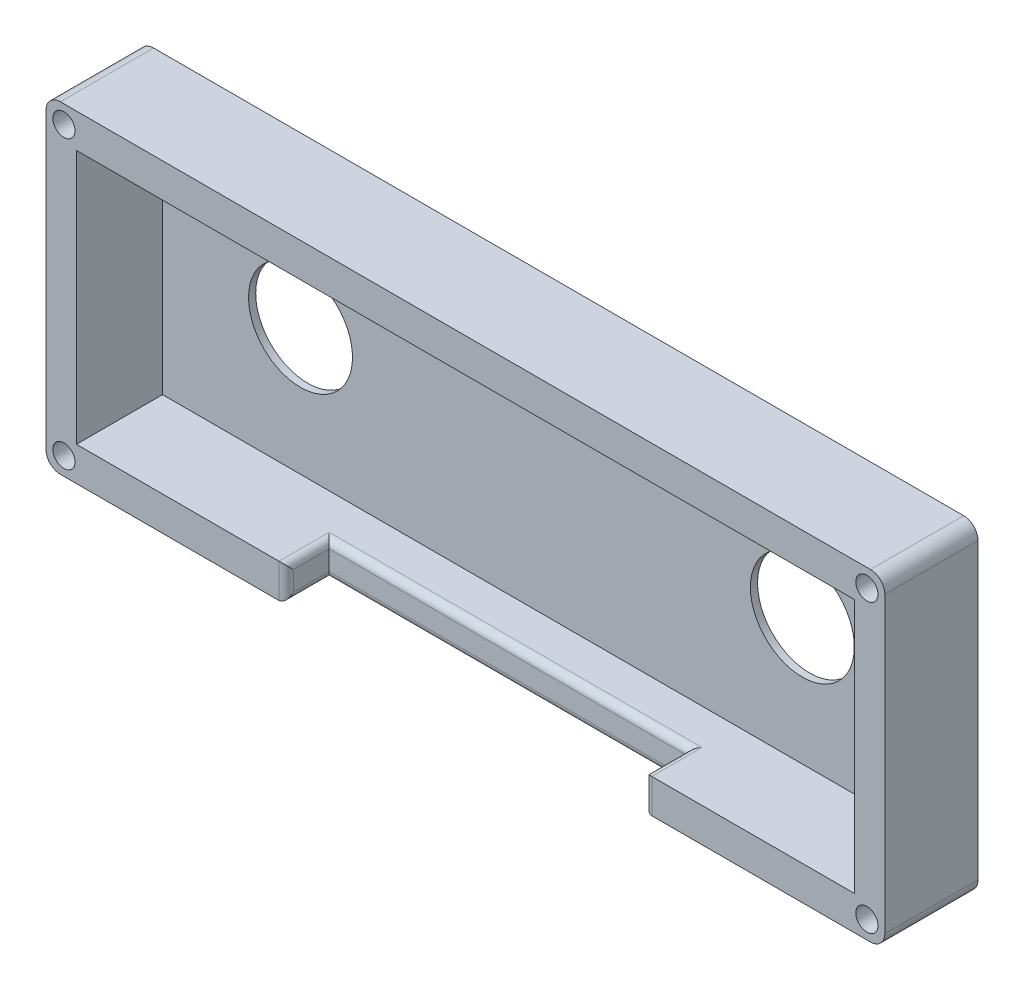
from build123d import *

# Parameters (mm, degrees)
SKETCH_1_W          = 117
SKETCH_1_H          = 45
SKETCH_1_R          = 7.25
EXTRUDE_1_DEPTH     = 13
SKETCH_2_W          = 108.5
SKETCH_2_H          = 35.5
CUT_EXTRUDE_1_DEPTH = 12
SKETCH_3_R          = 1.55
CUT_EXTRUDE_2_DEPTH = 6
SKETCH_4_W          = 50
SKETCH_4_H          = 10.556130204
CUT_EXTRUDE_3_DEPTH = 6
FILLET_1_R          = 2
FILLET_2_R          = 1


with BuildPart() as part:
    # 草图1 → 凸台-拉伸1 (new body)
    with BuildSketch(Plane.XY):
        Rectangle(SKETCH_1_W, SKETCH_1_H)
        with Locations(Location((-35, 0, 0), (0, 0, 180))):
            Circle(SKETCH_1_R, mode=Mode.SUBTRACT)
        with Locations(Location((35, 0, 0), (0, 0, 180))):
            Circle(SKETCH_1_R, mode=Mode.SUBTRACT)
    extrude(amount=EXTRUDE_1_DEPTH)

    # 草图2 → 切除-拉伸1 (cut)
    with BuildSketch(Plane.XY.offset(13)):
        Rectangle(SKETCH_2_W, SKETCH_2_H)
    extrude(amount=-CUT_EXTRUDE_1_DEPTH, mode=Mode.SUBTRACT)

    # 草图3 → 切除-拉伸2 (cut)
    with BuildSketch(Plane.XY.offset(13)):
        with Locations((-56, 20)):
            Circle(SKETCH_3_R)
        with Locations(Location((-56, -20, 0), (0, 0, 180))):
            Circle(SKETCH_3_R)
        with Locations((56, -20)):
            Circle(SKETCH_3_R)
        with Locations(Location((56, 20, 0), (0, 0, 180))):
            Circle(SKETCH_3_R)
    extrude(amount=-CUT_EXTRUDE_2_DEPTH, mode=Mode.SUBTRACT)

    # 草图4 → 切除-拉伸3 (cut)
    with BuildSketch(Plane.XY.offset(13)):
        with Locations((0, -20)):
            Rectangle(SKETCH_4_W, SKETCH_4_H)
    extrude(amount=-CUT_EXTRUDE_3_DEPTH, mode=Mode.SUBTRACT)

    # 圆角1
    fillet_1_edges = [part.edges().sort_by_distance(p)[0] for p in [
        (58.5, -22.5, 6.5),
        (-58.5, -22.5, 6.5),
        (-58.5, 22.5, 6.5),
        (58.5, 22.5, 6.5),
    ]]
    fillet(fillet_1_edges, radius=FILLET_1_R)

    # 圆角2
    fillet_2_edges = [part.edges().sort_by_distance(p)[0] for p in [
        (0, -17.75, 7),
        (25, -17.75, 10),
        (-25, -17.75, 10),
        (-25, -22.5, 10),
        (25, -22.5, 10),
        (0, -22.5, 7),
        (-25, -20.125, 13),
        (25, -20.125, 13),
    ]]
    fillet(fillet_2_edges, radius=FILLET_2_R)


solid = part.part
